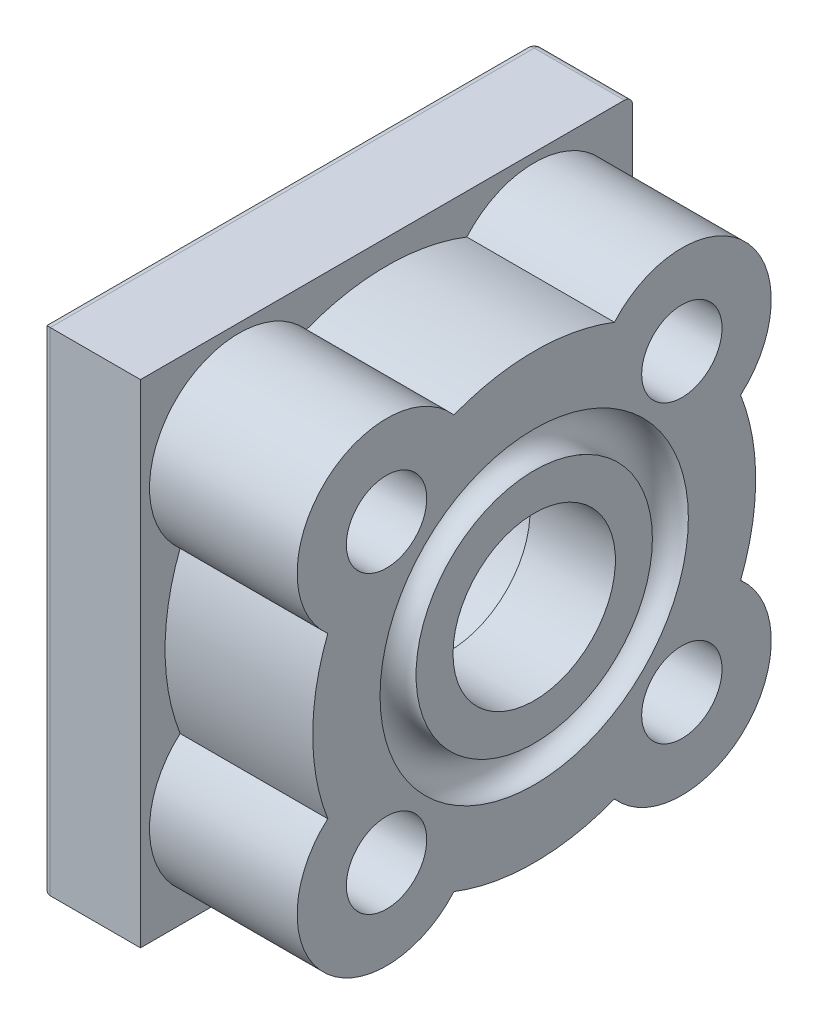
from build123d import *

# Parameters (mm, degrees)
SKETCH1_W           = 30
SKETCH1_H           = 30
BOSS_EXTRUDE1_DEPTH = 15
SKETCH2_R           = 2.45
CUT_EXTRUDE1_DEPTH  = 46
CUT_EXTRUDE2_DEPTH  = 6.5
SKETCH4_R           = 6.4
CUT_EXTRUDE3_DEPTH  = 3.3
SKETCH5_R           = 4.95
CUT_EXTRUDE4_DEPTH  = 44.543541427
SKETCH6_R           = 1.25
FILLET1_R           = 0.5
CUT_EXTRUDE5_DEPTH  = 3.2
SKETCH9_W           = 34
SKETCH9_H           = 34
CUT_EXTRUDE7_DEPTH  = 9


with BuildPart() as part:
    # Sketch1 → Boss-Extrude1 (new body)
    with BuildSketch(Plane(origin=(0, 0, 0), x_dir=(0, 0, -1), z_dir=(1, 0, 0))):
        with Locations((15, 15)):
            Rectangle(SKETCH1_W, SKETCH1_H)
    extrude(amount=BOSS_EXTRUDE1_DEPTH)

    # Sketch2 → Cut-Extrude1 (cut, through all)
    with BuildSketch(Plane.ZY):
        with Locations((-24, 24)):
            Circle(SKETCH2_R)
        with Locations((-6, 24)):
            Circle(SKETCH2_R)
        with Locations((-6, 6)):
            Circle(SKETCH2_R)
        with Locations((-24, 6)):
            Circle(SKETCH2_R)
    extrude(amount=-CUT_EXTRUDE1_DEPTH, mode=Mode.SUBTRACT)

    # Sketch3 → Cut-Extrude2 (cut)
    with BuildSketch(Plane.ZY):
        Polygon((-7.609916554, 15), (-11.304958277, 21.4), (-18.695041723, 21.4), (-22.390083446, 15), (-18.695041723, 8.6), (-11.304958277, 8.6), align=None)
    extrude(amount=-CUT_EXTRUDE2_DEPTH, mode=Mode.SUBTRACT)

    # Sketch4 → Cut-Extrude3 (cut)
    with BuildSketch(Plane.ZY.offset(-6.5)):
        with Locations((-15, 15)):
            Circle(SKETCH4_R)
    extrude(amount=-CUT_EXTRUDE3_DEPTH, mode=Mode.SUBTRACT)

    # Sketch5 → Cut-Extrude4 (cut, through all)
    with BuildSketch(Plane.ZY.offset(-9.8)):
        with Locations((-15, 15)):
            Circle(SKETCH5_R)
    extrude(amount=-CUT_EXTRUDE4_DEPTH, mode=Mode.SUBTRACT)

    # Sketch6 → Cut-Revolve1 (revolve, cut)
    with BuildSketch(Plane.XY.offset(-15), mode=Mode.PRIVATE) as cut_revolve1_sk:
        with Locations((14.4, 23.3)):
            Circle(SKETCH6_R)
    revolve(cut_revolve1_sk.sketch.rotate(Axis((9.8, 15, -15), (-1, 0, 0)), 90), axis=Axis((9.8, 15, -15), (-1, 0, 0)), mode=Mode.SUBTRACT)

    # Fillet1
    fillet1_edges = [part.edges().sort_by_distance(p)[0] for p in [
        (0, 30, -15),
        (0, 15, -30),
        (0, 0, -15),
        (0, 15, 0),
        (7.5, 30, -30),
        (7.5, 0, -30),
    ]]
    fillet(fillet1_edges, radius=FILLET1_R)

    # Sketch7 → Cut-Extrude5 (cut)
    with BuildSketch(Plane.ZY):
        Polygon((-18.630642497, 24), (-21.315321248, 28.65), (-26.684678752, 28.65), (-29.369357503, 24), (-26.684678752, 19.35), (-21.315321248, 19.35), align=None)
        Polygon((-0.630642497, 24), (-3.315321248, 28.65), (-8.684678752, 28.65), (-11.369357503, 24), (-8.684678752, 19.35), (-3.315321248, 19.35), align=None)
        Polygon((-0.630642497, 6), (-3.315321248, 10.65), (-8.684678752, 10.65), (-11.369357503, 6), (-8.684678752, 1.35), (-3.315321248, 1.35), align=None)
        Polygon((-18.630642497, 6), (-21.315321248, 10.65), (-26.684678752, 10.65), (-29.369357503, 6), (-26.684678752, 1.35), (-21.315321248, 1.35), align=None)
    extrude(amount=-CUT_EXTRUDE5_DEPTH, mode=Mode.SUBTRACT)

    # Sketch9 → Cut-Extrude7 (cut)
    with BuildSketch(Plane(origin=(15, 0, 0), x_dir=(0, 0, -1), z_dir=(1, 0, 0))):
        with Locations((15, 15)):
            Rectangle(SKETCH9_W, SKETCH9_H)
        with BuildLine():
            ThreePointArc((10.107346068, 27.582207179), (2.146268043, 27.853731957), (2.417792821, 19.892653932))
            ThreePointArc((2.417792821, 19.892653932), (1.5, 15), (2.417792821, 10.107346068))
            ThreePointArc((2.417792821, 10.107346068), (2.146268043, 2.146268043), (10.107346068, 2.417792821))
            ThreePointArc((10.107346068, 2.417792821), (15, 1.5), (19.892653932, 2.417792821))
            ThreePointArc((19.892653932, 2.417792821), (27.853731957, 2.146268043), (27.582207179, 10.107346068))
            ThreePointArc((27.582207179, 10.107346068), (28.5, 15), (27.582207179, 19.892653932))
            ThreePointArc((27.582207179, 19.892653932), (27.853731957, 27.853731957), (19.892653932, 27.582207179))
            ThreePointArc((19.892653932, 27.582207179), (15, 28.5), (10.107346068, 27.582207179))
        make_face(mode=Mode.SUBTRACT)
    extrude(amount=-CUT_EXTRUDE7_DEPTH, mode=Mode.SUBTRACT)


solid = part.part
